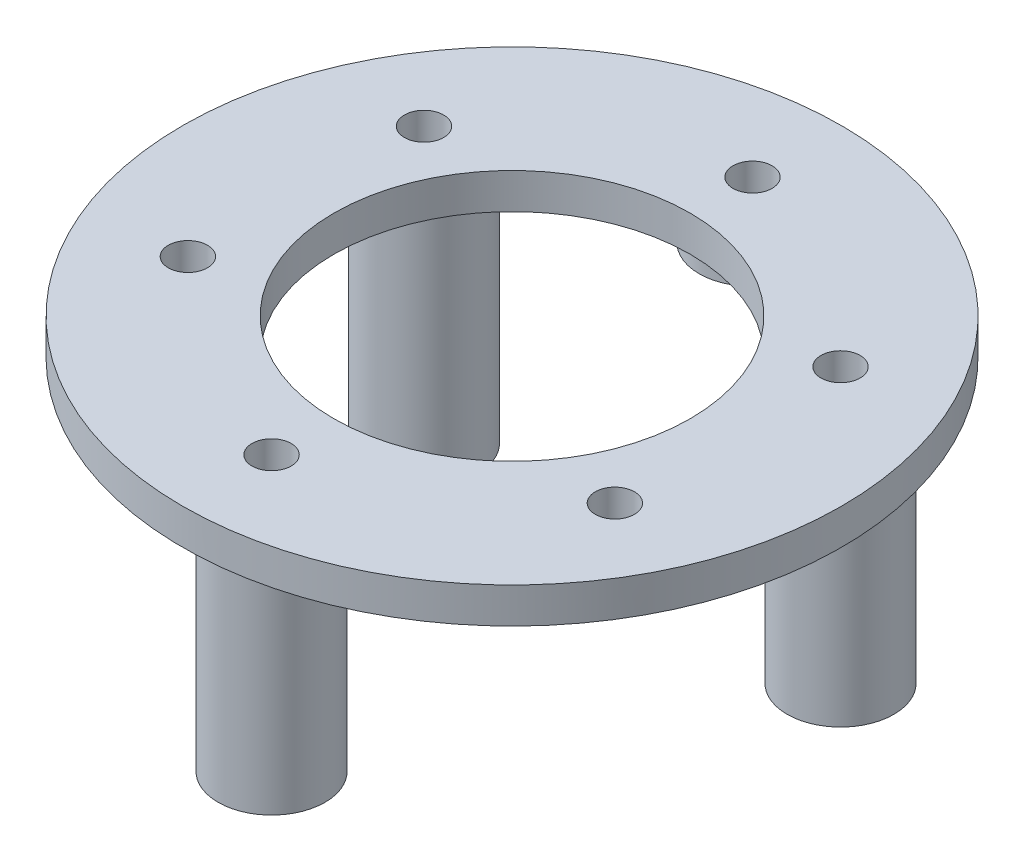
from build123d import *

# Parameters (mm, degrees)
SKETCH_1_R          = 18.5
SKETCH_1_R_2        = 10
SKETCH_1_R_3        = 1.1
EXTRUDE_1_DEPTH     = 2
EXTRUDE_START       = -3.2
SKETCH_2_R          = 3
SKETCH_2_R_2        = 1.1
EXTRUDE_2_DEPTH     = 1.2
SKETCH_3_R          = 1.1
CUT_EXTRUDE_1_DEPTH = 27.357921011
SKETCH_4_R          = 3
SKETCH_4_R_2        = 1.1
EXTRUDE_3_DEPTH     = 13.4
CUT_EXTRUDE_2_DEPTH = 0.44


with BuildPart() as part:
    # Эскиз1 → Бобышка-Вытянуть1 (new body)
    with BuildSketch(Plane(origin=(0, 0, 0), x_dir=(1, 0, 0), z_dir=(0, 1, 0))):
        with Locations(Location((0, 0, 0), (0, 0, 270))):
            Circle(SKETCH_1_R)
        with Locations(Location((0, 0, 0), (0, 0, 270))):
            Circle(SKETCH_1_R_2, mode=Mode.SUBTRACT)
        with Locations(Location((0, 13.5, 0), (0, 0, 270))):
            Circle(SKETCH_1_R_3, mode=Mode.SUBTRACT)
        with Locations(Location((11.985507699, -6.212697095, 0), (0, 0, 270))):
            Circle(SKETCH_1_R_3, mode=Mode.SUBTRACT)
        with Locations(Location((-11.985507699, -6.212697095, 0), (0, 0, 270))):
            Circle(SKETCH_1_R_3, mode=Mode.SUBTRACT)
    extrude(amount=EXTRUDE_1_DEPTH)

    # Эскиз2 → Бобышка-Вытянуть2 (add)
    # profile 1 of 3: a face of its own
    with BuildSketch(Plane(origin=(0, 2, 0), x_dir=(1, 0, 0), z_dir=(0, 1, 0)).offset(EXTRUDE_START)):
        with Locations(Location((0, 13.5, 0), (0, 0, 270))):
            Circle(SKETCH_2_R)
        with Locations(Location((0, 13.5, 0), (0, 0, 270))):
            Circle(SKETCH_2_R_2, mode=Mode.SUBTRACT)
    # profile 2 of 3: a face of its own
    with BuildSketch(Plane(origin=(0, 2, 0), x_dir=(1, 0, 0), z_dir=(0, 1, 0)).offset(EXTRUDE_START)):
        with Locations(Location((-11.985507699, -6.212697095, 0), (0, 0, 270))):
            Circle(SKETCH_2_R)
        with Locations(Location((-11.985507699, -6.212697095, 0), (0, 0, 270))):
            Circle(SKETCH_2_R_2, mode=Mode.SUBTRACT)
    # profile 3 of 3: a face of its own
    with BuildSketch(Plane(origin=(0, 2, 0), x_dir=(1, 0, 0), z_dir=(0, 1, 0)).offset(EXTRUDE_START)):
        with Locations(Location((11.985507699, -6.212697095, 0), (0, 0, 270))):
            Circle(SKETCH_2_R)
        with Locations(Location((11.985507699, -6.212697095, 0), (0, 0, 270))):
            Circle(SKETCH_2_R_2, mode=Mode.SUBTRACT)
    extrude(amount=EXTRUDE_2_DEPTH)

    # Эскиз3 → Вырез-Вытянуть1 (cut, through all)
    with BuildSketch(Plane(origin=(0, 2, 0), x_dir=(1, 0, 0), z_dir=(0, 1, 0))):
        with Locations(Location((-11.691342951, 6.75, 0), (0, 0, 270))):
            Circle(SKETCH_3_R)
        with Locations(Location((11.691342951, 6.75, 0), (0, 0, 270))):
            Circle(SKETCH_3_R)
        with Locations(Location((0, -13.5, 0), (0, 0, 270))):
            Circle(SKETCH_3_R)
    extrude(amount=-CUT_EXTRUDE_1_DEPTH, mode=Mode.SUBTRACT)

    # Эскиз4 → Бобышка-Вытянуть3 (add)
    # profile 1 of 3: a face of its own
    with BuildSketch(Plane.XZ):
        with Locations(Location((-11.691342951, -6.75, 0), (0, 0, 90))):
            Circle(SKETCH_4_R)
        with Locations(Location((-11.691342951, -6.75, 0), (0, 0, 90))):
            Circle(SKETCH_4_R_2, mode=Mode.SUBTRACT)
    # profile 2 of 3: a face of its own
    with BuildSketch(Plane.XZ):
        with Locations(Location((0, 13.5, 0), (0, 0, 90))):
            Circle(SKETCH_4_R)
        with Locations(Location((0, 13.5, 0), (0, 0, 90))):
            Circle(SKETCH_4_R_2, mode=Mode.SUBTRACT)
    # profile 3 of 3: a face of its own
    with BuildSketch(Plane.XZ):
        with Locations(Location((11.691342951, -6.75, 0), (0, 0, 90))):
            Circle(SKETCH_4_R)
        with Locations(Location((11.691342951, -6.75, 0), (0, 0, 90))):
            Circle(SKETCH_4_R_2, mode=Mode.SUBTRACT)
    extrude(amount=EXTRUDE_3_DEPTH)

    # Эскиз5 → Вырез-Вытянуть2 (cut)
    with BuildSketch(Plane.XZ):
        Polygon((-8.383974596, -16.52146997), (-6.383974596, -13.057368355), (-8.116025404, -12.057368355), (-10.116025404, -15.52146997), align=None)
    extrude(amount=-CUT_EXTRUDE_2_DEPTH, mode=Mode.SUBTRACT)


solid = part.part
